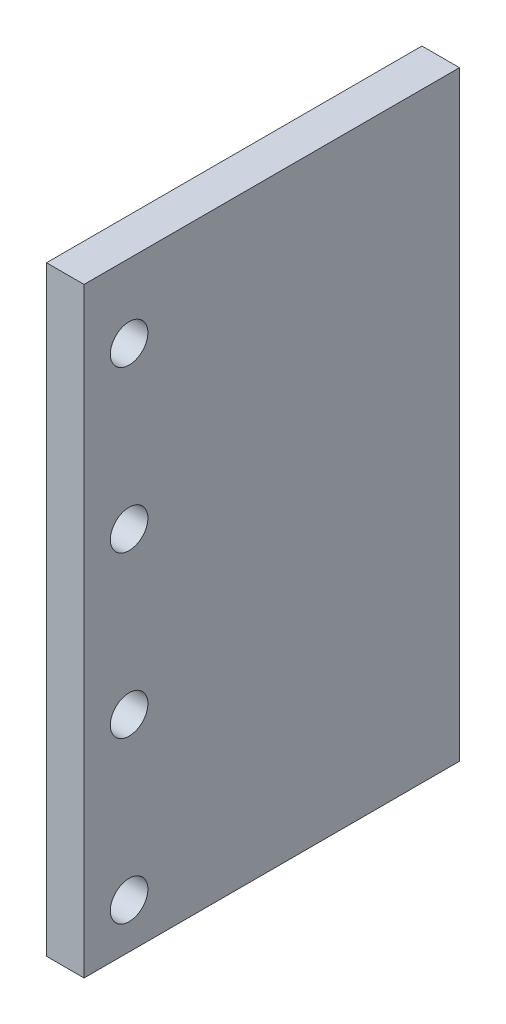
from build123d import *

# Parameters (mm, degrees)
IZIM1_W                     = 40
IZIM1_H                     = 25
IZIM1_R                     = 1.25
Y_KSEKLIK_EKSTR_ZYON1_DEPTH = 2.5


with BuildPart() as part:
    # Çizim1 → Yükseklik-Ekstrüzyon1 (new body)
    with BuildSketch(Plane.YZ):
        with Locations((20, 12.5)):
            Rectangle(IZIM1_W, IZIM1_H)
        with Locations(Location((3, 22, 0), (0, 0, 270))):
            Circle(IZIM1_R, mode=Mode.SUBTRACT)
        with Locations(Location((13.7, 22, 0), (0, 0, 270))):
            Circle(IZIM1_R, mode=Mode.SUBTRACT)
        with Locations(Location((24.4, 22, 0), (0, 0, 270))):
            Circle(IZIM1_R, mode=Mode.SUBTRACT)
        with Locations(Location((35.1, 22, 0), (0, 0, 270))):
            Circle(IZIM1_R, mode=Mode.SUBTRACT)
    extrude(amount=Y_KSEKLIK_EKSTR_ZYON1_DEPTH)


solid = part.part
